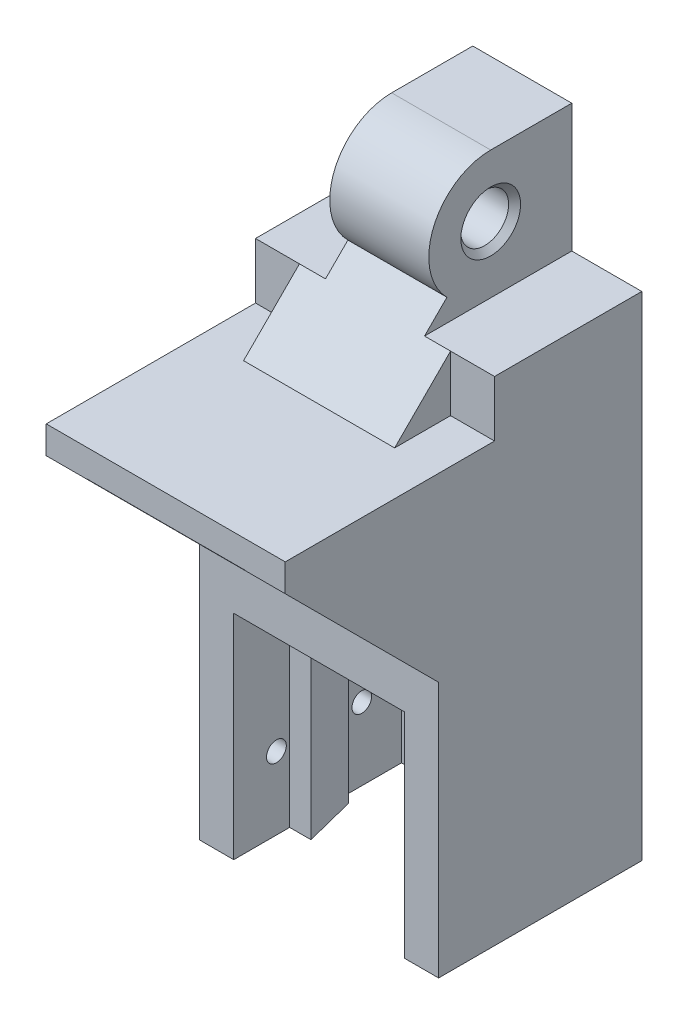
from build123d import *

# Parameters (mm, degrees)
SKETCH1_W                = 26
SKETCH1_H                = 28
BOSS_EXTRUDE1_DEPTH      = 50
CUT_EXTRUDE3_DEPTH       = 39
SKETCH14_R               = 7.25
BOSS_EXTRUDE7_DEPTH      = 5.8
SKETCH15_R               = 2.8
CUT_EXTRUDE4_DEPTH       = 28
CUT_EXTRUDE7_DEPTH       = 54.29223677
SKETCH19_R               = 2.15
CUT_EXTRUDE9_DEPTH       = 50
ESQUISSE1_W              = 17.371158736
ESQUISSE1_H              = 10.855066753
ENL_V_MAT_EXTRU_1_DEPTH  = 7.5
ENL_V_START              = -7.2
ESQUISSE3_W              = 17.25
ESQUISSE3_H              = 8.423951408
ENL_V_MAT_EXTRU_3_DEPTH  = 7.2
ESQUISSE43_W             = 18.6
ESQUISSE43_H             = 18
ENL_V_MAT_EXTRU_4_DEPTH  = 20
BOSS_EXTRU_28_DEPTH      = 23
ENL_V_MAT_EXTRU_5_DEPTH  = 25
ENL_V_MAT_EXTRU_6_DEPTH  = 7
ESQUISSE48_R             = 4
BOSS_EXTRU_29_DEPTH      = 6
ESQUISSE51_R             = 2.15
ENL_V_MAT_EXTRU_9_DEPTH  = 12
ESQUISSE53_W             = 6.55
ESQUISSE53_H             = 26.2
BOSS_EXTRU_30_DEPTH      = 3.7
ESQUISSE54_W             = 6.55
ESQUISSE54_H             = 26.2
BOSS_EXTRU_31_DEPTH      = 3.7
ESQUISSE55_W             = 3
ESQUISSE55_H             = 25
BOSS_EXTRU_32_DEPTH      = 6.55
ESQUISSE56_R             = 1.15
ESQUISSE56_R_2           = 1.16
ENL_V_MAT_EXTRU_11_DEPTH = 10
CHANFREIN1_SIZE          = 0.7
ESQUISSE57_R             = 2.15
ENL_V_MAT_EXTRU_12_DEPTH = 10
BOSS_EXTRU_33_START      = 1
ESQUISSE58_R             = 1.15
ESQUISSE58_R_2           = 1.16
BOSS_EXTRU_33_DEPTH      = 1
BOSS_EXTRU_34_DEPTH      = 1
ESQUISSE61_W             = 0.45
ESQUISSE61_H             = 6.55
ENL_V_MAT_EXTRU_13_DEPTH = 15
BOSS_EXTRU_35_DEPTH      = 25
ENL_V_MAT_EXTRU_14_DEPTH = 41
ENL_V_MAT_EXTRU_15_DEPTH = 33


with BuildPart() as part:
    # Sketch1 → Boss-Extrude1 (new body)
    with BuildSketch(Plane(origin=(0, 0, 0), x_dir=(1, 0, 0), z_dir=(0, 1, 0))):
        Rectangle(SKETCH1_W, SKETCH1_H)
    extrude(amount=BOSS_EXTRUDE1_DEPTH)

    # Sketch7 → Cut-Extrude3 (cut)
    with BuildSketch(Plane(origin=(13, 0, 0), x_dir=(0, 0, -1), z_dir=(1, 0, 0))):
        with BuildLine():
            Line((4.5, 50), (-14, 50))
            Line((-14, 50), (-14, 24))
            Line((-14, 24), (-0.626524164, 37.373475836))
            ThreePointArc((-0.626524164, 37.373475836), (11.198126611, 39.725545115), (4.5, 49.75))
            Line((4.5, 49.75), (14, 49.75))
            Line((14, 49.75), (14, 50))
            Line((14, 50), (4.5, 50))
        make_face()
    extrude(amount=-CUT_EXTRUDE3_DEPTH, mode=Mode.SUBTRACT)

    # Sketch14 → Boss-Extrude7 (add, symmetric)
    with BuildSketch(Plane(origin=(0, 0, 0), x_dir=(0, 0, -1), z_dir=(1, 0, 0))):
        with Locations((4.5, 42.5)):
            Circle(SKETCH14_R)
    boss_extrude7 = extrude(amount=BOSS_EXTRUDE7_DEPTH, both=True)

    # Symétrie1: Boss-Extrude7 across plane
    add(boss_extrude7.mirror(Plane(origin=(0, 0, 0), x_dir=(0, 0, 1), z_dir=(1, 0, 0))))

    # Sketch15 → Cut-Extrude4 (cut)
    with BuildSketch(Plane(origin=(13, 0, 0), x_dir=(0, 0, -1), z_dir=(1, 0, 0))):
        with Locations((4.5, 42.5)):
            Circle(SKETCH15_R)
    extrude(amount=-CUT_EXTRUDE4_DEPTH, mode=Mode.SUBTRACT)

    # Sketch17 → Cut-Extrude7 (cut, through all)
    with BuildSketch(Plane.XZ):
        Polygon((-9.3, 3.25), (-13, 3.25), (-13, 14), (13, 14), (13, 3.25), (9.3, 3.25), (9.3, 9.8), (-9.3, 9.8), align=None)
    extrude(amount=-CUT_EXTRUDE7_DEPTH, mode=Mode.SUBTRACT)

    # Sketch19 → Cut-Extrude9 (cut)
    with BuildSketch(Plane(origin=(0, 0, -14), x_dir=(-1, 0, 0), z_dir=(0, 0, -1))):
        with Locations((0, 16)):
            Circle(SKETCH19_R)
    extrude(amount=-CUT_EXTRUDE9_DEPTH, mode=Mode.SUBTRACT)

    # Esquisse1 → Enlèv. mat.-Extru.1 (cut)
    with BuildSketch(Plane(origin=(0, 49.75, 0), x_dir=(1, 0, 0), z_dir=(0, 1, 0))):
        with Locations((-14.485579368, 9.927533377)):
            Rectangle(ESQUISSE1_W, ESQUISSE1_H)
    enl_v_mat_extru_1 = extrude(amount=-ENL_V_MAT_EXTRU_1_DEPTH, mode=Mode.SUBTRACT)

    # Symétrie3: Enlèv. mat.-Extru.1 across plane
    add(enl_v_mat_extru_1.mirror(Plane(origin=(0, 0, 0), x_dir=(0, 0, 1), z_dir=(1, 0, 0))), mode=Mode.SUBTRACT)

    # Esquisse3 → Enlèv. mat.-Extru.3 (cut)
    with BuildSketch(Plane(origin=(13, 0, 0), x_dir=(0, 0, -1), z_dir=(1, 0, 0)).offset(ENL_V_START)):
        with Locations((5.375, 38.961975704)):
            Rectangle(ESQUISSE3_W, ESQUISSE3_H)
    enl_v_mat_extru_3 = extrude(amount=ENL_V_MAT_EXTRU_3_DEPTH, mode=Mode.SUBTRACT)

    # Symétrie4: Enlèv. mat.-Extru.3 across plane
    add(enl_v_mat_extru_3.mirror(Plane(origin=(0, 0, 0), x_dir=(0, 0, 1), z_dir=(1, 0, 0))), mode=Mode.SUBTRACT)

    # Esquisse43 → Enlèv. mat.-Extru.4 (cut)
    with BuildSketch(Plane.XY.offset(9.8)):
        with Locations((0, 16)):
            Rectangle(ESQUISSE43_W, ESQUISSE43_H)
    extrude(amount=-ENL_V_MAT_EXTRU_4_DEPTH, mode=Mode.SUBTRACT)

    # Esquisse45 → Boss.-Extru.28 (add)
    with BuildSketch(Plane.XZ):
        Polygon((-9.3, 3.25), (-9.3, 9.8), (9.3, 9.8), (9.3, 3.25), (13, 3.25), (13, -14), (-13, -14), (-13, 3.25), align=None)
    extrude(amount=BOSS_EXTRU_28_DEPTH)

    # Sketch3 → Enlèv. mat.-Extru.5 (cut)
    with BuildSketch(Plane(origin=(0, -23, 0), x_dir=(1, 0, 0), z_dir=(0, 1, 0))):
        Polygon((10, 2.65), (10, 9.85), (2.9, 9.85), (2.9, 5.85), (-2.9, 5.85), (-2.9, 9.85), (-10, 9.85), (-10, 2.65), (-9, 2.65), (-7.502829597, -3.25), (-10, -3.25), (-10, -14.961698536), (10, -14.961698536), (10, -3.25), (7.5, -3.25), (9, 2.65), align=None)
    extrude(amount=ENL_V_MAT_EXTRU_5_DEPTH, mode=Mode.SUBTRACT)

    # Esquisse47 → Enlèv. mat.-Extru.6 (cut)
    with BuildSketch(Plane(origin=(0, 2, 0), x_dir=(-1, 0, 0), z_dir=(0, -1, 0))):
        with BuildLine():
            Line((-9, 2.65), (-9, 5.85))
            Line((-9, 5.85), (-6.550876644, 5.85))
            ThreePointArc((-6.550876644, 5.85), (-2.9, 0.180002706), (-6.550876644, -5.489994589))
            Line((-6.550876644, -5.489994589), (-7.016727392, -5.489994589))
            Line((-7.016727392, -5.489994589), (-9, 2.65))
        make_face()
        with BuildLine():
            Line((6.550876644, 5.85), (9, 5.85))
            Line((9, 5.85), (9, 2.65))
            Line((9, 2.65), (7.016727392, -5.489994589))
            Line((7.016727392, -5.489994589), (6.550876644, -5.489994589))
            ThreePointArc((6.550876644, -5.489994589), (2.9, 0.180002706), (6.550876644, 5.85))
        make_face()
    extrude(amount=-ENL_V_MAT_EXTRU_6_DEPTH, mode=Mode.SUBTRACT)

    # Esquisse48 → Boss.-Extru.29 (add)
    with BuildSketch(Plane.XY.offset(-10.2)):
        with Locations((0, 16)):
            Circle(ESQUISSE48_R)
    extrude(amount=BOSS_EXTRU_29_DEPTH)

    # Esquisse51 → Enlèv. mat.-Extru.9 (cut)
    with BuildSketch(Plane.XY.offset(-5.85)):
        with Locations((0, -8)):
            Circle(ESQUISSE51_R)
    extrude(amount=-ENL_V_MAT_EXTRU_9_DEPTH, mode=Mode.SUBTRACT)

    # Esquisse53 → Boss.-Extru.30 (add)
    with BuildSketch(Plane.ZY.offset(9.3)):
        with Locations((6.525, 15.1)):
            Rectangle(ESQUISSE53_W, ESQUISSE53_H)
    extrude(amount=BOSS_EXTRU_30_DEPTH)

    # Esquisse54 → Boss.-Extru.31 (add)
    with BuildSketch(Plane(origin=(9.3, 0, 0), x_dir=(0, 0, -1), z_dir=(1, 0, 0))):
        with Locations((-6.525, 15.1)):
            Rectangle(ESQUISSE54_W, ESQUISSE54_H)
    extrude(amount=BOSS_EXTRU_31_DEPTH)

    # Esquisse55 → Boss.-Extru.32 (add)
    with BuildSketch(Plane.XY.offset(3.25)):
        with Locations((-11.5, -10.5)):
            Rectangle(ESQUISSE55_W, ESQUISSE55_H)
        with Locations((11.5, -10.5)):
            Rectangle(ESQUISSE55_W, ESQUISSE55_H)
    extrude(amount=BOSS_EXTRU_32_DEPTH)

    # Esquisse56 → Enlèv. mat.-Extru.11 (cut)
    with BuildSketch(Plane.ZY.offset(13)):
        with Locations((-5.2, -14.5)):
            Circle(ESQUISSE56_R)
        with Locations((4.8, -14.5)):
            Circle(ESQUISSE56_R_2)
    extrude(amount=-ENL_V_MAT_EXTRU_11_DEPTH, mode=Mode.SUBTRACT)

    # Chanfrein1
    chanfrein1_edges = [part.edges().sort_by_distance(p)[0] for p in [
        (5.8, 42.5, -1.7),
        (-5.8, 42.5, -1.7),
    ]]
    chamfer(chanfrein1_edges, length=CHANFREIN1_SIZE)

    # Esquisse57 → Enlèv. mat.-Extru.12 (cut)
    with BuildSketch(Plane(origin=(0, 0, -10.2), x_dir=(-1, 0, 0), z_dir=(0, 0, -1))):
        with Locations((0, 16)):
            Circle(ESQUISSE57_R)
    extrude(amount=-ENL_V_MAT_EXTRU_12_DEPTH, mode=Mode.SUBTRACT)

    # Esquisse58 → Boss.-Extru.33 (add)
    with BuildSketch(Plane.ZY.offset(13).offset(BOSS_EXTRU_33_START)):
        Polygon((-14, 34.75), (3.25, 34.75), (3.25, 28.2), (9.8, 28.2), (9.8, -23), (-14, -23), align=None)
        with Locations((-5.2, -14.5)):
            Circle(ESQUISSE58_R, mode=Mode.SUBTRACT)
        with Locations((4.8, -14.5)):
            Circle(ESQUISSE58_R_2, mode=Mode.SUBTRACT)
    extrude(amount=-BOSS_EXTRU_33_DEPTH)

    # Esquisse59 → Boss.-Extru.34 (add)
    with BuildSketch(Plane(origin=(13, 0, 0), x_dir=(0, 0, -1), z_dir=(1, 0, 0))):
        Polygon((-3.25, 28.2), (-3.25, 34.75), (14, 34.75), (14, -23), (-9.8, -23), (-9.8, 28.2), align=None)
    extrude(amount=BOSS_EXTRU_34_DEPTH)

    # Esquisse61 → Enlèv. mat.-Extru.13 (cut)
    with BuildSketch(Plane.XY.offset(3.25)):
        with Locations((-9.075, 31.475)):
            Rectangle(ESQUISSE61_W, ESQUISSE61_H)
        with Locations((9.075, 31.475)):
            Rectangle(ESQUISSE61_W, ESQUISSE61_H)
    extrude(amount=ENL_V_MAT_EXTRU_13_DEPTH, mode=Mode.SUBTRACT)

    # Esquisse62 → Boss.-Extru.35 (add)
    with BuildSketch(Plane.XY.offset(9.8)):
        Polygon((-9.3, 7), (-14, 7), (-14, 28.2), (14, 28.2), (14, 7), (9.3, 7), (9.3, 25), (-9.3, 25), align=None)
    extrude(amount=BOSS_EXTRU_35_DEPTH)

    # Esquisse63 → Enlèv. mat.-Extru.14 (cut)
    with BuildSketch(Plane(origin=(14, 0, 0), x_dir=(0, 0, -1), z_dir=(1, 0, 0))):
        Polygon((-9.8, 7), (-34.636706434, 31.836706434), (-43.129995532, 15.759057015), (-32.785249808, -2.73145904), (-31.803829731, -2.73145904), align=None)
    extrude(amount=-ENL_V_MAT_EXTRU_14_DEPTH, mode=Mode.SUBTRACT)

    # Esquisse64 → Enlèv. mat.-Extru.15 (cut)
    with BuildSketch(Plane.ZY.offset(14)):
        Polygon((31, 28.2), (27.766380883, 28.2), (27.766380883, 24.966380883), align=None)
    extrude(amount=-ENL_V_MAT_EXTRU_15_DEPTH, mode=Mode.SUBTRACT)


solid = part.part
